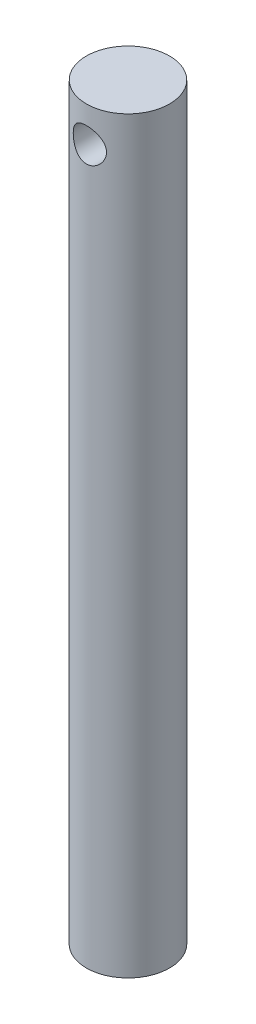
from build123d import *

# Parameters (mm, degrees)
EXTRUDE_START       = -20
SKETCH_1_R          = 10
EXTRUDE_1_DEPTH     = 180
SKETCH_2_R          = 4
CUT_EXTRUDE_2_DEPTH = 25


with BuildPart() as part:
    # Эскиз1 → Вытянуть1 (new body)
    with BuildSketch(Plane(origin=(0, 0, 0), x_dir=(1, 0, 0), z_dir=(0, 1, 0)).offset(EXTRUDE_START)):
        with Locations(Location((0, 0, 0), (0, 0, 90))):
            Circle(SKETCH_1_R)
    extrude(amount=EXTRUDE_1_DEPTH)

    # Эскиз2 → Вытянуть2 (cut, symmetric)
    with BuildSketch(Plane.XY):
        with Locations(Location((0, 151.5, 0), (0, 0, 89.999999999))):
            Circle(SKETCH_2_R)
    extrude(amount=CUT_EXTRUDE_2_DEPTH, both=True, mode=Mode.SUBTRACT)


solid = part.part
